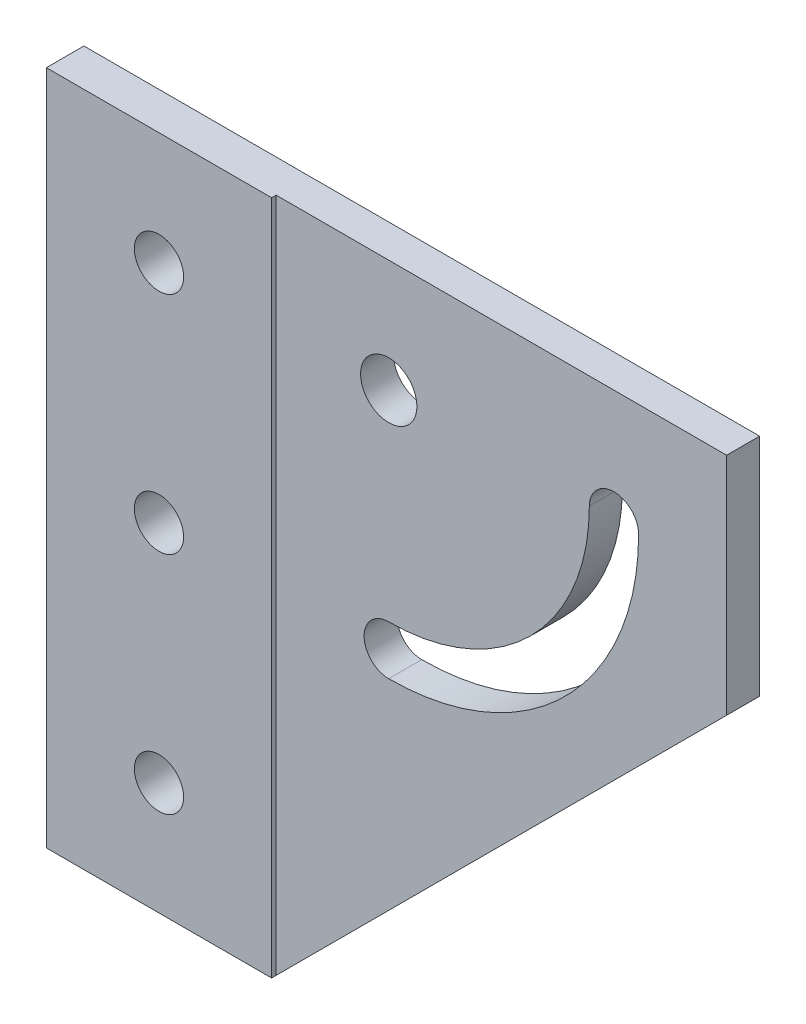
from build123d import *

# Parameters (mm, degrees)
BOSS_EXTRUDE1_DEPTH  = 5.588
SKETCH2_W            = 38.1
SKETCH2_H            = 114.3
BOSS_EXTRUDE2_DEPTH  = 0.762
CUT_EXTRUDE1_DEPTH   = 109.03221727
HOLE1_D              = 8.3312
HOLE2_D              = 8.3312
HOLE3_D              = 8.3312
M8_CLEARANCE_HOLE1_D = 9.525


with BuildPart() as part:
    # Sketch1 → Boss-Extrude1 (new body)
    with BuildSketch(Plane(origin=(0, 0, -17.198296107), x_dir=(-1, 0, 0), z_dir=(0, 0, -1))):
        Polygon((-47.86260239, 85.004743533), (-47.86260239, 46.904743533), (28.33739761, -29.295256467), (66.43739761, -29.295256467), (66.43739761, 85.004743533), align=None)
    extrude(amount=-BOSS_EXTRUDE1_DEPTH)

    # Sketch2 → Boss-Extrude2 (add)
    with BuildSketch(Plane.XY.offset(-11.610296107)):
        with Locations((-47.38739761, 27.854743533)):
            Rectangle(SKETCH2_W, SKETCH2_H)
    extrude(amount=BOSS_EXTRUDE2_DEPTH)

    # Sketch3 → Cut-Extrude1 (cut, through all)
    with BuildSketch(Plane.XY.offset(-11.610296107)):
        with BuildLine():
            ThreePointArc((-9.28739761, 23.689143533), (20.598894761, 36.068451162), (32.97820239, 65.954743533))
            ThreePointArc((32.97820239, 65.954743533), (28.81260239, 70.120343533), (24.64700239, 65.954743533))
            ThreePointArc((24.64700239, 65.954743533), (14.707846746, 41.959499178), (-9.28739761, 32.020343533))
            ThreePointArc((-9.28739761, 32.020343533), (-13.45299761, 27.854743533), (-9.28739761, 23.689143533))
        make_face()
    extrude(amount=-CUT_EXTRUDE1_DEPTH, mode=Mode.SUBTRACT)

    # Hole1 (through all)
    with Locations(Plane.XY.offset(-10.848296107)):
        with Locations((-47.38739761, -10.245256467)):
            Hole(HOLE1_D / 2)

    # Hole2 (through all)
    with Locations(Plane.XY.offset(-10.848296107)):
        with Locations((-47.38739761, 65.954743533)):
            Hole(HOLE2_D / 2)

    # Hole3 (through all)
    with Locations(Plane.XY.offset(-10.848296107)):
        with Locations((-47.38739761, 27.854743533)):
            Hole(HOLE3_D / 2)

    # M8 Clearance Hole1 (through all)
    with Locations(Plane.XY.offset(-11.610296107)):
        with Locations((-9.28739761, 65.954743533)):
            Hole(M8_CLEARANCE_HOLE1_D / 2)


solid = part.part
